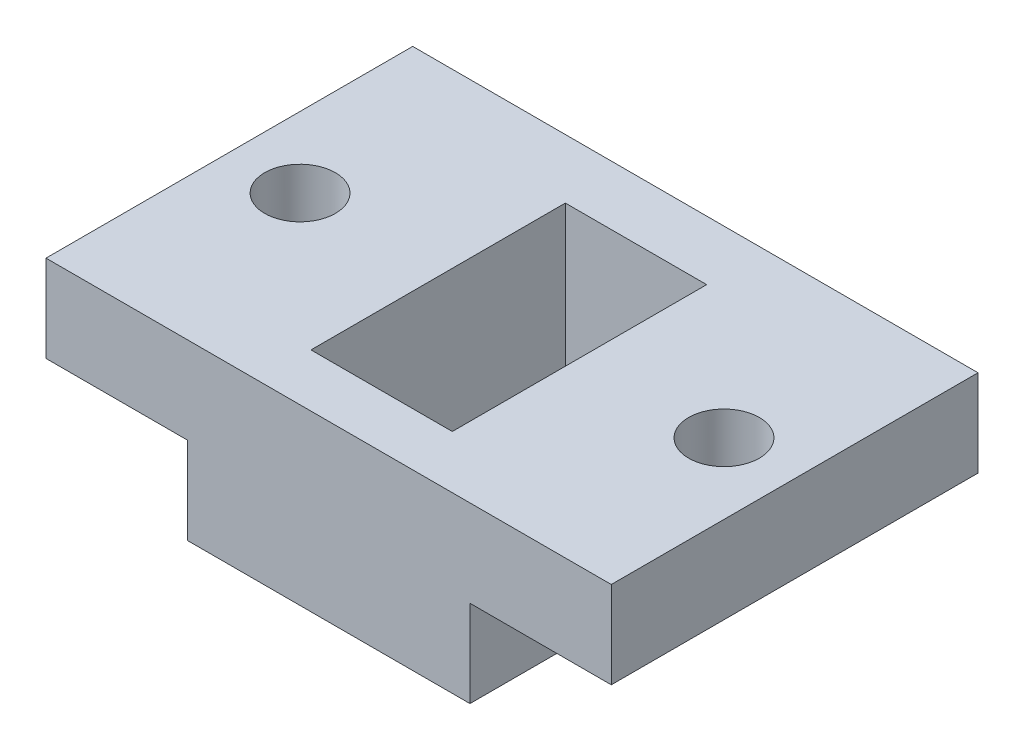
from build123d import *

# Parameters (mm, degrees)
SKETCH1_W           = 25.4
SKETCH1_H           = 15.621
BOSS_EXTRUDE1_DEPTH = 12.7
SKETCH4_W           = 6.35
SKETCH4_H           = 15.621
BOSS_EXTRUDE4_DEPTH = 22.86
SKETCH5_W           = 25.4
SKETCH5_H           = 7.9375
CUT_EXTRUDE1_DEPTH  = 15.748
SKETCH6_W           = 25.4
SKETCH6_H           = 15.621
BOSS_EXTRUDE5_DEPTH = 5.334
SKETCH7_W           = 32.9565
SKETCH7_H           = 7.8105
BOSS_EXTRUDE6_DEPTH = 12.7
SKETCH8_W           = 32.9565
SKETCH8_H           = 7.8105
BOSS_EXTRUDE7_DEPTH = 12.7
SKETCH9_R           = 3.175
CUT_EXTRUDE2_DEPTH  = 12.7


with BuildPart() as part:
    # Sketch1 → Boss-Extrude1 (new body)
    with BuildSketch(Plane.XY):
        Rectangle(SKETCH1_W, SKETCH1_H)
    extrude(amount=BOSS_EXTRUDE1_DEPTH)

    # Sketch4 → Boss-Extrude4 (add)
    with BuildSketch(Plane(origin=(0, 0, 0), x_dir=(-1, 0, 0), z_dir=(0, 0, -1))):
        with Locations((9.525, 0)):
            Rectangle(SKETCH4_W, SKETCH4_H)
        with Locations((-9.525, 0)):
            Rectangle(SKETCH4_W, SKETCH4_H)
    extrude(amount=BOSS_EXTRUDE4_DEPTH)

    # Sketch5 → Cut-Extrude1 (cut)
    with BuildSketch(Plane(origin=(0, 7.8105, 0), x_dir=(1, 0, 0), z_dir=(0, 1, 0))):
        with Locations((0, -8.73125)):
            Rectangle(SKETCH5_W, SKETCH5_H)
    extrude(amount=-CUT_EXTRUDE1_DEPTH, mode=Mode.SUBTRACT)

    # Sketch6 → Boss-Extrude5 (add)
    with BuildSketch(Plane(origin=(0, 0, -22.86), x_dir=(-1, 0, 0), z_dir=(0, 0, -1))):
        Rectangle(SKETCH6_W, SKETCH6_H)
    extrude(amount=BOSS_EXTRUDE5_DEPTH)

    # Sketch7 → Boss-Extrude6 (add)
    with BuildSketch(Plane.ZY.offset(12.7)):
        with Locations((-11.71575, 3.90525)):
            Rectangle(SKETCH7_W, SKETCH7_H)
    extrude(amount=BOSS_EXTRUDE6_DEPTH)

    # Sketch8 → Boss-Extrude7 (add)
    with BuildSketch(Plane(origin=(12.7, 0, 0), x_dir=(0, 0, -1), z_dir=(1, 0, 0))):
        with Locations((11.71575, 3.90525)):
            Rectangle(SKETCH8_W, SKETCH8_H)
    extrude(amount=BOSS_EXTRUDE7_DEPTH)

    # Sketch9 → Cut-Extrude2 (cut)
    with BuildSketch(Plane.XZ):
        with Locations((-19.05, -11.71575)):
            Circle(SKETCH9_R)
        with Locations((19.05, -11.71575)):
            Circle(SKETCH9_R)
    extrude(amount=-CUT_EXTRUDE2_DEPTH, mode=Mode.SUBTRACT)


solid = part.part
